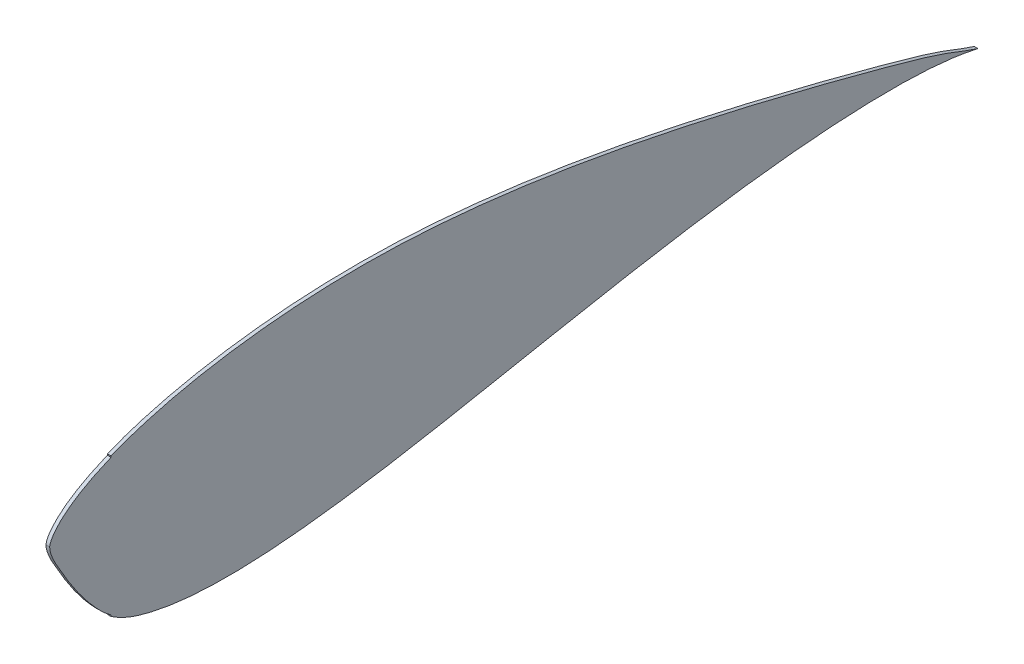
from build123d import *

# Parameters (mm, degrees)
BOSS_EXTRUDE2_DEPTH = 3.175


with BuildPart() as part:
    # Sketch2 → Boss-Extrude2 (new body)
    with BuildSketch(Plane(origin=(266.7, 0, 0), x_dir=(0, 0, -1), z_dir=(1, 0, 0))):
        with BuildLine():
            Line((53.975, -77.204508027), (53.975, -78.419412207))
            add(Edge.make_bspline(
                [(53.975, -78.419412207), (57.393939715, -80.776121472), (66.842733973, -86.13701714), (84.452765046, -91.717357185), (106.852134498, -96.151510734), (132.510932076, -98.572249175), (161.194365788, -99.092382868), (192.761343292, -97.704243711), (227.038217577, -94.511839296), (263.834756502, -89.663828123), (302.921473177, -83.388445028), (344.017776041, -75.977786804), (386.776799789, -67.780707382), (430.77461487, -59.202323955), (475.496263681, -50.66380512), (520.335279967, -42.603612471), (564.588870456, -35.422796347), (607.4709344, -29.473308084), (648.127538759, -25.014473383), (685.667615873, -22.186241782), (719.196759596, -21.00476141), (747.830287498, -21.278636312), (770.688405743, -22.854711922), (787.091395164, -25.07351564), (796.842303095, -26.819328187), (801.097715575, -27.775140745), (802.151053399, -28.011732033)],
                knots=[0.113056669, 0.113056669, 0.113056669, 0.113056669, 0.127599777, 0.150892793, 0.177565203, 0.207667777, 0.241222088, 0.278203414, 0.318526303, 0.362030579, 0.408464625, 0.457479062, 0.508614437, 0.561296015, 0.614835295, 0.668437534, 0.721214466, 0.772202341, 0.820393483, 0.864765923, 0.904323704, 0.938131581, 0.965241743, 0.984690447, 0.996210442, 1, 1, 1, 1], degree=3))
            add(Edge.make_bspline(
                [(802.151053399, -28.011732033), (801.137231832, -27.710542124), (797.278434829, -26.564156251), (789.357225956, -23.458600593), (777.06146068, -18.643579076), (760.581722214, -13.040064966), (739.99675031, -7.1233282), (715.577161881, -0.379813283), (687.646997389, 7.013021798), (656.683490083, 14.958443735), (623.15891656, 23.258345049), (587.549187868, 31.694376174), (550.31922689, 40.026159278), (511.914813655, 48.001625947), (472.761711337, 55.374538475), (433.262164148, 61.912775617), (393.795881302, 67.404801186), (354.719946084, 71.655180259), (316.356950184, 74.535698451), (278.931254814, 75.753587714), (242.69940893, 75.393823286), (207.870582877, 73.546655951), (174.746776105, 70.258980652), (143.601377813, 65.768183379), (114.762118239, 60.187460639), (88.534490153, 53.628471164), (68.561648347, 47.303164595), (57.431887436, 43.056839639), (53.975, 41.651039403)],
                knots=[0, 0, 0, 0, 0.003802345, 0.014472446, 0.030563625, 0.051299059, 0.07702847, 0.107573811, 0.142399413, 0.180921149, 0.22252468, 0.266590974, 0.312514686, 0.359710118, 0.407632337, 0.455773217, 0.503669018, 0.550900956, 0.597096183, 0.641976048, 0.685511898, 0.727353252, 0.767353583, 0.805169064, 0.840471252, 0.872937278, 0.902335209, 0.915751061, 0.915751061, 0.915751061, 0.915751061], degree=3))
            Line((53.975, 41.651039403), (53.975, 40.570467669))
            add(Edge.make_bspline(
                [(53.975, 40.570467669), (52.223886058, 39.855098624), (46.55545684, 37.466004168), (37.125856967, 33.052667662), (27.830126078, 27.881861429), (20.719091852, 23.242104552), (15.614495512, 19.455137028), (10.786663524, 15.322063664), (6.429543979, 10.752121577), (3.329781232, 6.520651809), (1.766394253, 3.289416468), (1.234579927, 1.629552357), (1.070917704, 0.808496148), (1.022680145, 0.373573872), (1.00777339, 0.114040658), (1.00092143, -0.010571576)],
                knots=[0.916241011, 0.916241011, 0.916241011, 0.916241011, 0.923068013, 0.938443772, 0.953819531, 0.961507411, 0.96919529, 0.97688317, 0.98457105, 0.992258929, 0.996102869, 0.998024839, 0.998985824, 0.999466316, 0.999946809, 0.999946809, 0.999946809, 0.999946809], degree=3))
            add(Edge.make_bspline(
                [(1.00092143, -0.010571576), (1.009923866, -0.277884036), (1.028927427, -0.823363497), (1.102768583, -1.825860344), (1.416760314, -3.597204949), (2.45215177, -7.203197251), (4.557690792, -12.131446446), (7.694252843, -17.87383852), (12.081452023, -25.466401501), (17.732189245, -34.79647061), (24.919919042, -45.768224894), (31.457640354, -54.481000173), (37.047635253, -61.18254607), (42.853610743, -67.720036372), (48.449554365, -73.119796986), (52.936471607, -76.472448044), (53.975, -77.204508027)],
                knots=[5.1727e-05, 5.1727e-05, 5.1727e-05, 5.1727e-05, 0.001013083, 0.00197444, 0.003897153, 0.007742579, 0.015433432, 0.023124285, 0.030815138, 0.046196844, 0.06157855, 0.076960256, 0.084651109, 0.092341962, 0.107723668, 0.112236216, 0.112236216, 0.112236216, 0.112236216], degree=3))
        make_face()
    extrude(amount=-BOSS_EXTRUDE2_DEPTH)


solid = part.part
